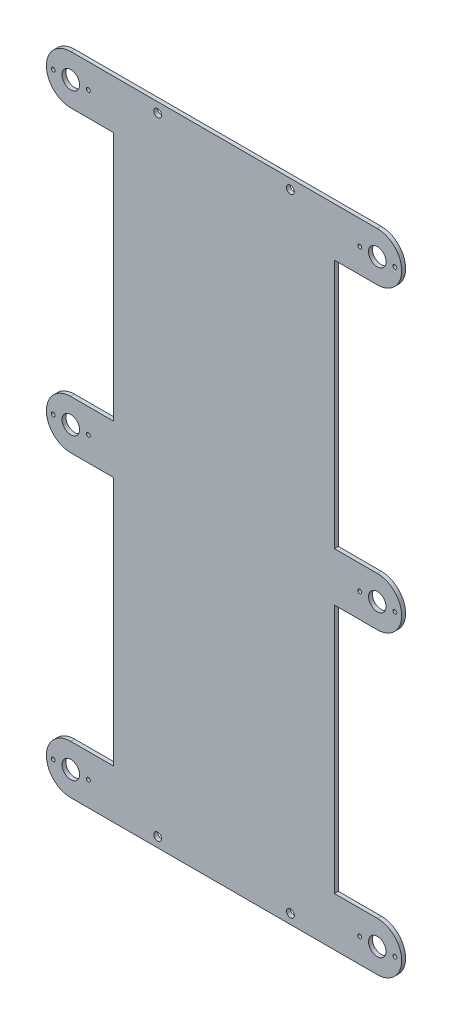
from build123d import *

# Parameters (mm, degrees)
ESQUISSE1_R        = 4.5
ESQUISSE1_R_2      = 2
ESQUISSE1_R_3      = 1
BOSS_EXTRU_1_DEPTH = 2


with BuildPart() as part:
    # Esquisse1 → Boss.-Extru.1 (new body)
    with BuildSketch(Plane.XY):
        with BuildLine():
            Line((-78.5, 165.5), (78.5, 165.5))
            ThreePointArc((78.5, 165.5), (91, 153), (78.5, 140.5))
            Line((78.5, 140.5), (56.5, 140.5))
            Line((56.5, 140.5), (56.5, 12.5))
            Line((56.5, 12.5), (78.5, 12.5))
            ThreePointArc((78.5, 12.5), (91, 0), (78.5, -12.5))
            Line((78.5, -12.5), (56.5, -12.5))
            Line((56.5, -12.5), (56.5, -140.5))
            Line((56.5, -140.5), (78.5, -140.5))
            ThreePointArc((78.5, -140.5), (91, -153), (78.5, -165.5))
            Line((78.5, -165.5), (-78.5, -165.5))
            ThreePointArc((-78.5, -165.5), (-91, -153), (-78.5, -140.5))
            Line((-78.5, -140.5), (-56.5, -140.5))
            Line((-56.5, -140.5), (-56.5, -12.5))
            Line((-56.5, -12.5), (-78.5, -12.5))
            ThreePointArc((-78.5, -12.5), (-91, 0), (-78.5, 12.5))
            Line((-78.5, 12.5), (-56.5, 12.5))
            Line((-56.5, 12.5), (-56.5, 140.5))
            Line((-56.5, 140.5), (-78.5, 140.5))
            ThreePointArc((-78.5, 140.5), (-91, 153), (-78.5, 165.5))
        make_face()
        with Locations((78.5, 153)):
            Circle(ESQUISSE1_R, mode=Mode.SUBTRACT)
        with Locations((78.5, 0)):
            Circle(ESQUISSE1_R, mode=Mode.SUBTRACT)
        with Locations((78.5, -153)):
            Circle(ESQUISSE1_R, mode=Mode.SUBTRACT)
        with Locations((34, 160.5)):
            Circle(ESQUISSE1_R_2, mode=Mode.SUBTRACT)
        with Locations((69.5, 153)):
            Circle(ESQUISSE1_R_3, mode=Mode.SUBTRACT)
        with Locations(Location((87.5, 153, 0), (0, 0, 180))):
            Circle(ESQUISSE1_R_3, mode=Mode.SUBTRACT)
        with Locations((69.5, 0)):
            Circle(ESQUISSE1_R_3, mode=Mode.SUBTRACT)
        with Locations((69.5, -153)):
            Circle(ESQUISSE1_R_3, mode=Mode.SUBTRACT)
        with Locations(Location((87.5, 0, 0), (0, 0, 180))):
            Circle(ESQUISSE1_R_3, mode=Mode.SUBTRACT)
        with Locations(Location((87.5, -153, 0), (0, 0, 180))):
            Circle(ESQUISSE1_R_3, mode=Mode.SUBTRACT)
        with Locations(Location((34, -160.5, 0), (0, 0, 180))):
            Circle(ESQUISSE1_R_2, mode=Mode.SUBTRACT)
        with Locations(Location((-78.5, 153, 0), (0, 0, 180))):
            Circle(ESQUISSE1_R, mode=Mode.SUBTRACT)
        with Locations((-87.5, 153)):
            Circle(ESQUISSE1_R_3, mode=Mode.SUBTRACT)
        with Locations(Location((-69.5, 153, 0), (0, 0, 180))):
            Circle(ESQUISSE1_R_3, mode=Mode.SUBTRACT)
        with Locations(Location((-34, 160.5, 0), (0, 0, 180))):
            Circle(ESQUISSE1_R_2, mode=Mode.SUBTRACT)
        with Locations((-87.5, 0)):
            Circle(ESQUISSE1_R_3, mode=Mode.SUBTRACT)
        with Locations(Location((-78.5, 0, 0), (0, 0, 180))):
            Circle(ESQUISSE1_R, mode=Mode.SUBTRACT)
        with Locations(Location((-69.5, 0, 0), (0, 0, 180))):
            Circle(ESQUISSE1_R_3, mode=Mode.SUBTRACT)
        with Locations((-87.5, -153)):
            Circle(ESQUISSE1_R_3, mode=Mode.SUBTRACT)
        with Locations(Location((-69.5, -153, 0), (0, 0, 180))):
            Circle(ESQUISSE1_R_3, mode=Mode.SUBTRACT)
        with Locations(Location((-78.5, -153, 0), (0, 0, 180))):
            Circle(ESQUISSE1_R, mode=Mode.SUBTRACT)
        with Locations((-34, -160.5)):
            Circle(ESQUISSE1_R_2, mode=Mode.SUBTRACT)
    extrude(amount=BOSS_EXTRU_1_DEPTH)


solid = part.part
